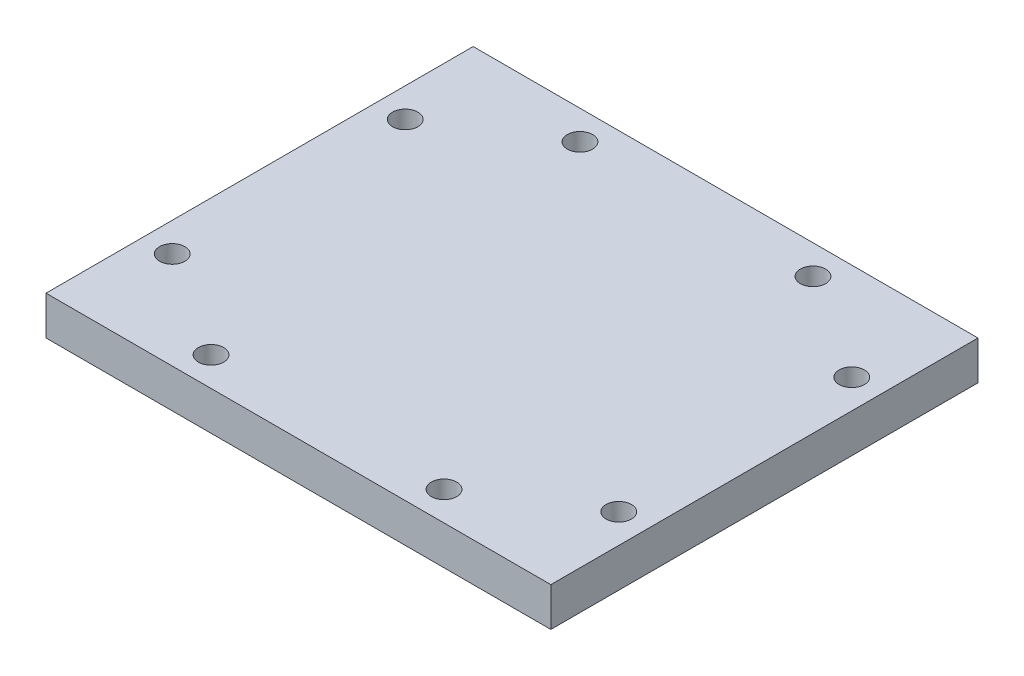
from build123d import *

# Parameters (mm, degrees)
SKETCH2_W             = 65
SKETCH2_H             = 55
BOSS_EXTRUDE1_DEPTH   = 5
F_4_CLEARANCE_HOLE1_D = 3.2639


with BuildPart() as part:
    # Sketch2 → Boss-Extrude1 (new body)
    with BuildSketch(Plane(origin=(0, 0, 0), x_dir=(1, 0, 0), z_dir=(0, 1, 0))):
        Rectangle(SKETCH2_W, SKETCH2_H)
    extrude(amount=BOSS_EXTRUDE1_DEPTH)

    # #4 Clearance Hole1 (through all)
    with Locations(Plane(origin=(0, 0, 0), x_dir=(-1, 0, 0), z_dir=(0, -1, 0))):
        with Locations((-28.75, 15), (-15, 23.75), (15, 23.75), (28.75, 15), (28.75, -15), (15, -23.75), (-15, -23.75), (-28.75, -15)):
            Hole(F_4_CLEARANCE_HOLE1_D / 2)


solid = part.part
